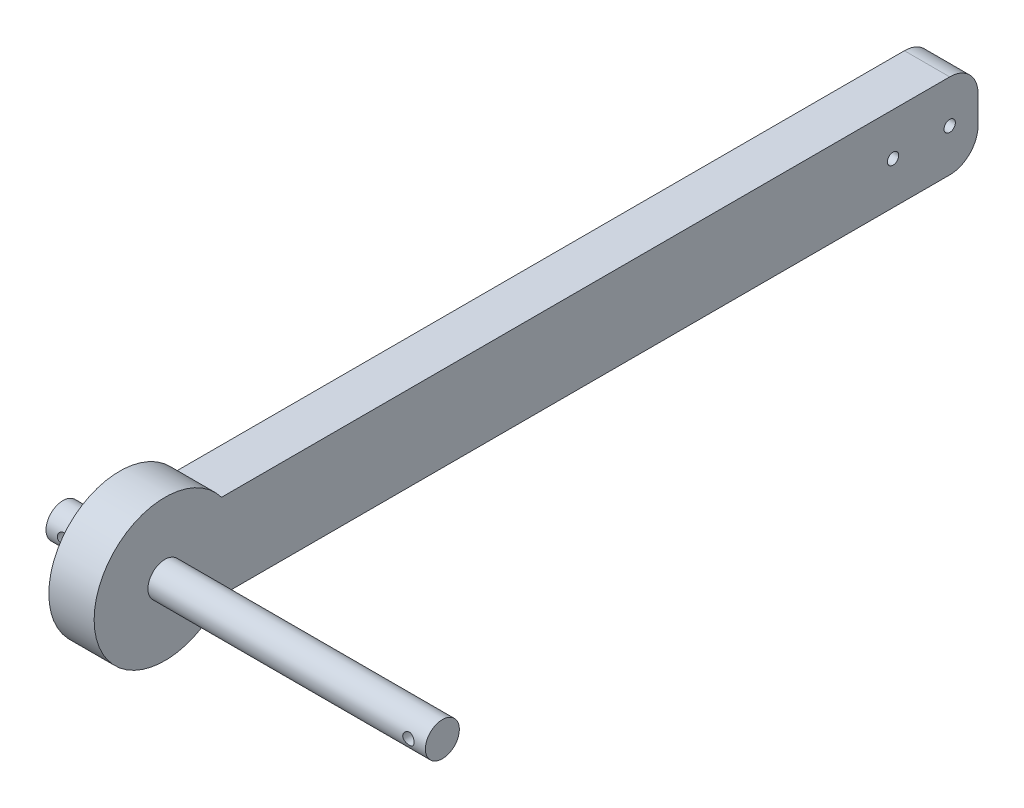
from build123d import *

# Parameters (mm, degrees)
SKETCH_1_W           = 150
SKETCH_1_H           = 15
EXTRUDE_1_DEPTH      = 8
FILLET_1_R           = 5
SKETCH_6_R           = 12.5
EXTRUDE_2_DEPTH      = 8
SKETCH_11_R          = 1
CUT_EXTRUDE_8_DEPTH  = 10
EXTRUDE_5_DEPTH      = 10
EXTRUDE_5_DEPTH_BACK = 57
SKETCH_15_R          = 3
CUT_EXTRUDE_9_REACH  = 163.707
SKETCH_16_R          = 1


with BuildPart() as part:
    # 草图1 → 凸台-拉伸1 (new body)
    with BuildSketch(Plane(origin=(0, 0, 0), x_dir=(0, 0, -1), z_dir=(1, 0, 0))):
        with Locations((75, 7.5)):
            Rectangle(SKETCH_1_W, SKETCH_1_H)
    extrude(amount=EXTRUDE_1_DEPTH)

    # 圆角1
    fillet_1_edges = [part.edges().sort_by_distance(p)[0] for p in [
        (4, 15, 0),
        (4, 15, -150),
        (4, 0, -150),
        (4, 0, 0),
    ]]
    fillet(fillet_1_edges, radius=FILLET_1_R)

    # 草图6 → 凸台-拉伸2 (add)
    with BuildSketch(Plane(origin=(8, 0, 0), x_dir=(0, 0, -1), z_dir=(1, 0, 0))):
        with Locations((6.4, 7.5)):
            Circle(SKETCH_6_R)
    extrude(amount=-EXTRUDE_2_DEPTH)

    # 草图11 → 切除-拉伸8 (cut)
    with BuildSketch(Plane.ZY):
        with Locations((-145, 7.5)):
            Circle(SKETCH_11_R)
        with Locations((-135, 7.5)):
            Circle(SKETCH_11_R)
        with Locations((85, 7.5)):
            Circle(SKETCH_11_R)
        with Locations((95, 7.5)):
            Circle(SKETCH_11_R)
    extrude(amount=-CUT_EXTRUDE_8_DEPTH, mode=Mode.SUBTRACT)

    # 草图15 → 凸台-拉伸5 (add, two sides: drawn at the far end of the back side and taken through both)
    with BuildSketch(Plane.ZY.offset(-EXTRUDE_5_DEPTH_BACK)):
        with Locations((-6.4, 7.5)):
            Circle(SKETCH_15_R)
    extrude(amount=EXTRUDE_5_DEPTH + EXTRUDE_5_DEPTH_BACK)

    # 草图16 → 切除-拉伸9 (cut, up to next)
    with BuildSketch(Plane.XY, mode=Mode.PRIVATE) as cut_extrude_9_sk1:
        with Locations((-7, 7.5)):
            Circle(SKETCH_16_R)
    cut_extrude_9_tool1 = extrude(cut_extrude_9_sk1.sketch, amount=-CUT_EXTRUDE_9_REACH, mode=Mode.PRIVATE) & part.part
    # 草图16 → 切除-拉伸9 (cut, up to next)
    with BuildSketch(Plane.XY, mode=Mode.PRIVATE) as cut_extrude_9_sk2:
        with Locations((54, 7.5)):
            Circle(SKETCH_16_R)
    cut_extrude_9_tool2 = extrude(cut_extrude_9_sk2.sketch, amount=-CUT_EXTRUDE_9_REACH, mode=Mode.PRIVATE) & part.part
    add(cut_extrude_9_tool1.solids().sort_by_distance((-7, 7.5, 0))[0], mode=Mode.SUBTRACT)
    add(cut_extrude_9_tool2.solids().sort_by_distance((54, 7.5, 0))[0], mode=Mode.SUBTRACT)


solid = part.part
